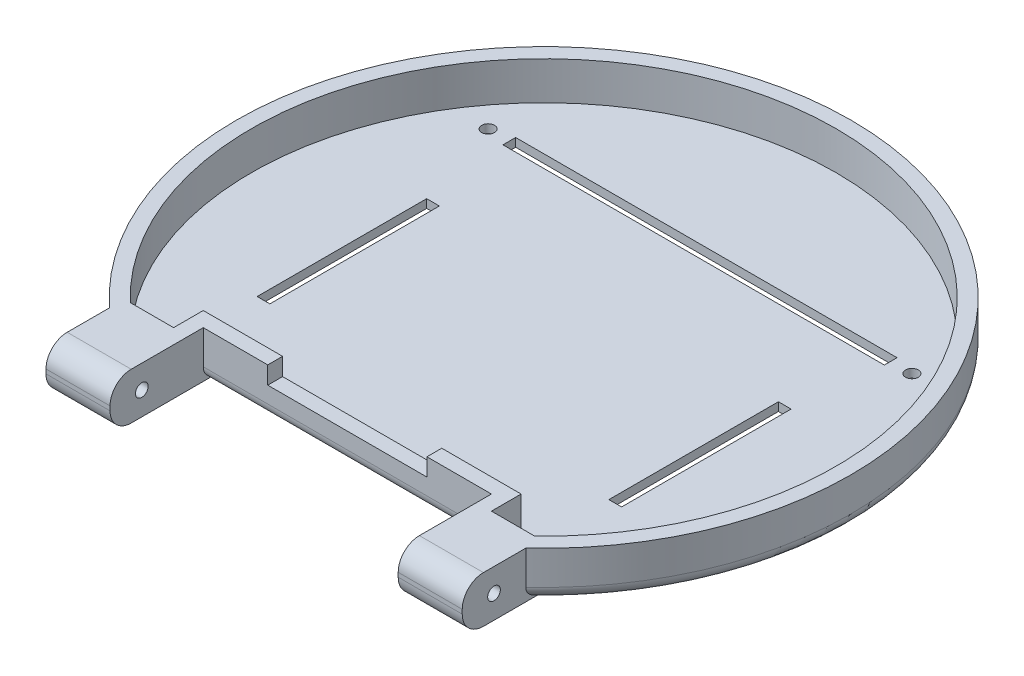
from build123d import *

# Parameters (mm, degrees)
SKETCH1_R           = 1.5
SKETCH1_W           = 3
SKETCH1_H           = 40
SKETCH1_W_2         = 90
SKETCH1_H_2         = 3
BOSS_EXTRUDE1_DEPTH = 2
BOSS_EXTRUDE2_DEPTH = 11
SKETCH3_W           = 15.108365525
SKETCH3_H           = 11
BOSS_EXTRUDE3_DEPTH = 15
SKETCH4_R           = 1.5
CUT_EXTRUDE1_DEPTH  = 115
FILLET2_R           = 3
FILLET3_R           = 5
SKETCH5_W           = 37.563728852
SKETCH5_H           = 8.292532788
CUT_EXTRUDE2_DEPTH  = 10


with BuildPart() as part:
    # Sketch1 → Boss-Extrude1 (new body)
    with BuildSketch(Plane(origin=(0, 0, 0), x_dir=(1, 0, 0), z_dir=(0, 1, 0))):
        with BuildLine():
            ThreePointArc((49.108365525, -55.238537207), (0, 70.596427268), (-49.108365525, -55.238537207))
            Line((-49.108365525, -55.238537207), (-34, -55.238537207))
            Line((-34, -55.238537207), (-34, -48.239677752))
            Line((-34, -48.239677752), (34, -48.239677752))
            Line((34, -48.239677752), (34, -55.238537207))
            Line((34, -55.238537207), (49.108365525, -55.238537207))
        make_face()
        with Locations((-25.778764696, -40.884208465)):
            Circle(SKETCH1_R, mode=Mode.SUBTRACT)
        with Locations((-41.5, -6.523357214)):
            Rectangle(SKETCH1_W, SKETCH1_H, mode=Mode.SUBTRACT)
        with Locations((25.778764693, -40.884208467)):
            Circle(SKETCH1_R, mode=Mode.SUBTRACT)
        with Locations((41.5, -6.523357214)):
            Rectangle(SKETCH1_W, SKETCH1_H, mode=Mode.SUBTRACT)
        with Locations((-50, 34.976642786)):
            Circle(SKETCH1_R, mode=Mode.SUBTRACT)
        with Locations((0, 34.976642786)):
            Rectangle(SKETCH1_W_2, SKETCH1_H_2, mode=Mode.SUBTRACT)
        with Locations((50, 34.976642786)):
            Circle(SKETCH1_R, mode=Mode.SUBTRACT)
    extrude(amount=BOSS_EXTRUDE1_DEPTH)

    # Sketch1<3> → Boss-Extrude2 (add)
    with BuildSketch(Plane(origin=(0, 0, 0), x_dir=(1, 0, 0), z_dir=(0, 1, 0))):
        with BuildLine():
            ThreePointArc((49.108365525, -55.238537207), (0, 70.596427268), (-49.108365525, -55.238537207))
            Line((-49.108365525, -55.238537207), (-34, -55.238537207))
            Line((-34, -55.238537207), (-34, -48.239677752))
            Line((-34, -48.239677752), (34, -48.239677752))
            Line((34, -48.239677752), (34, -55.238537207))
            Line((34, -55.238537207), (49.108365525, -55.238537207))
        make_face()
        with BuildLine():
            Line((-37.5, -51.738537207), (-47.722911854, -51.738537207))
            ThreePointArc((-47.722911854, -51.738537207), (0, 67.096427268), (47.722911854, -51.738537207))
            Line((47.722911854, -51.738537207), (37.5, -51.738537207))
            Line((37.5, -51.738537207), (37.5, -44.739677752))
            Line((37.5, -44.739677752), (-37.5, -44.739677752))
            Line((-37.5, -44.739677752), (-37.5, -51.738537207))
        make_face(mode=Mode.SUBTRACT)
    extrude(amount=BOSS_EXTRUDE2_DEPTH)

    # Sketch3 → Boss-Extrude3 (add)
    with BuildSketch(Plane.XY.offset(55.238537207)):
        with Locations((41.554182763, 5.5)):
            Rectangle(SKETCH3_W, SKETCH3_H)
        with Locations((-41.554182763, 5.5)):
            Rectangle(SKETCH3_W, SKETCH3_H)
    extrude(amount=BOSS_EXTRUDE3_DEPTH)

    # Sketch4 → Cut-Extrude1 (cut)
    with BuildSketch(Plane.ZY.offset(49.108365525)):
        with Locations((62.738537207, 5.5)):
            Circle(SKETCH4_R)
    extrude(amount=-CUT_EXTRUDE1_DEPTH, mode=Mode.SUBTRACT)

    # Fillet2
    fillet2_edges = [part.edges().sort_by_distance(p)[0] for p in [
        (0, 0, 48.239677752),
        (0, 0, -70.596427268),
    ]]
    fillet(fillet2_edges, radius=FILLET2_R)

    # Fillet3
    fillet3_edges = [part.edges().sort_by_distance(p)[0] for p in [
        (41.554182762, 0, 70.238537207),
        (41.554182762, 11, 70.238537207),
        (-41.554182762, 0, 70.238537207),
        (-41.554182762, 11, 70.238537207),
    ]]
    fillet(fillet3_edges, radius=FILLET3_R)

    # Sketch5 → Cut-Extrude2 (cut)
    with BuildSketch(Plane.XY.offset(48.239677752)):
        with Locations((0, 11)):
            Rectangle(SKETCH5_W, SKETCH5_H)
    extrude(amount=-CUT_EXTRUDE2_DEPTH, mode=Mode.SUBTRACT)


solid = part.part
